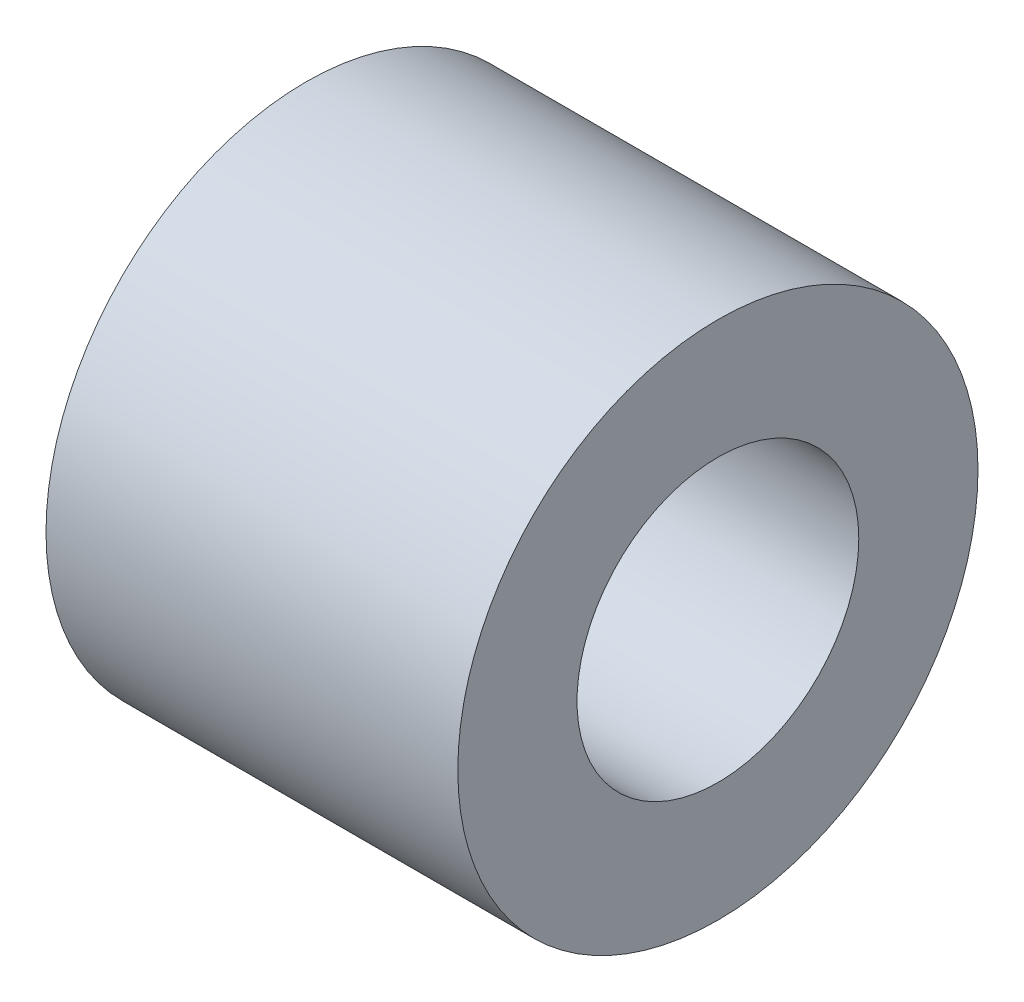
from build123d import *

# Parameters (mm, degrees)
SKETCH1_R           = 2.4
BOSS_EXTRUDE1_DEPTH = 3.8
SKETCH2_R           = 1.3
CUT_EXTRUDE1_DEPTH  = 3.8


with BuildPart() as part:
    # Sketch1 → Boss-Extrude1 (new body)
    with BuildSketch(Plane(origin=(0, 0, 0), x_dir=(0, 0, -1), z_dir=(1, 0, 0))):
        with Locations(Location((0, 0, 0), (0, 0, 180))):
            Circle(SKETCH1_R)
    extrude(amount=BOSS_EXTRUDE1_DEPTH)

    # Sketch2 → Cut-Extrude1 (cut)
    with BuildSketch(Plane(origin=(3.8, 0, 0), x_dir=(0, 0, -1), z_dir=(1, 0, 0))):
        Circle(SKETCH2_R)
    extrude(amount=-CUT_EXTRUDE1_DEPTH, mode=Mode.SUBTRACT)


solid = part.part
